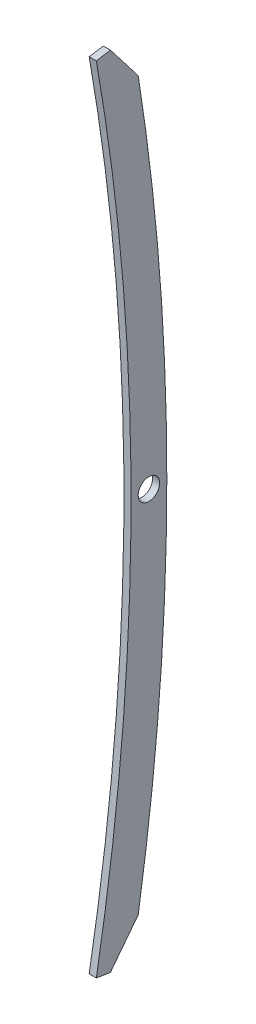
from build123d import *

# Parameters (mm, degrees)
SKETCH1_R           = 3.81
BOSS_EXTRUDE1_DEPTH = 1.27


with BuildPart() as part:
    # Sketch1 → Boss-Extrude1 (new, symmetric)
    with BuildSketch(Plane.YZ):
        with BuildLine():
            Line((141.141238808, -800.451741648), (141.93592589, -805.469198419))
            Line((141.93592589, -805.469198419), (129.136650891, -815.336725161))
            ThreePointArc((129.136650891, -815.336725161), (0, -825.5), (-129.136650891, -815.336725161))
            Line((-129.136650891, -815.336725161), (-141.93592589, -805.469198419))
            Line((-141.93592589, -805.469198419), (-141.141238808, -800.451741648))
            ThreePointArc((-141.141238808, -800.451741648), (0, -812.8), (141.141238808, -800.451741648))
        make_face()
        with Locations(Location((0, -819.15, 0), (0, 0, 270))):
            Circle(SKETCH1_R, mode=Mode.SUBTRACT)
    extrude(amount=BOSS_EXTRUDE1_DEPTH, both=True)


solid = part.part
